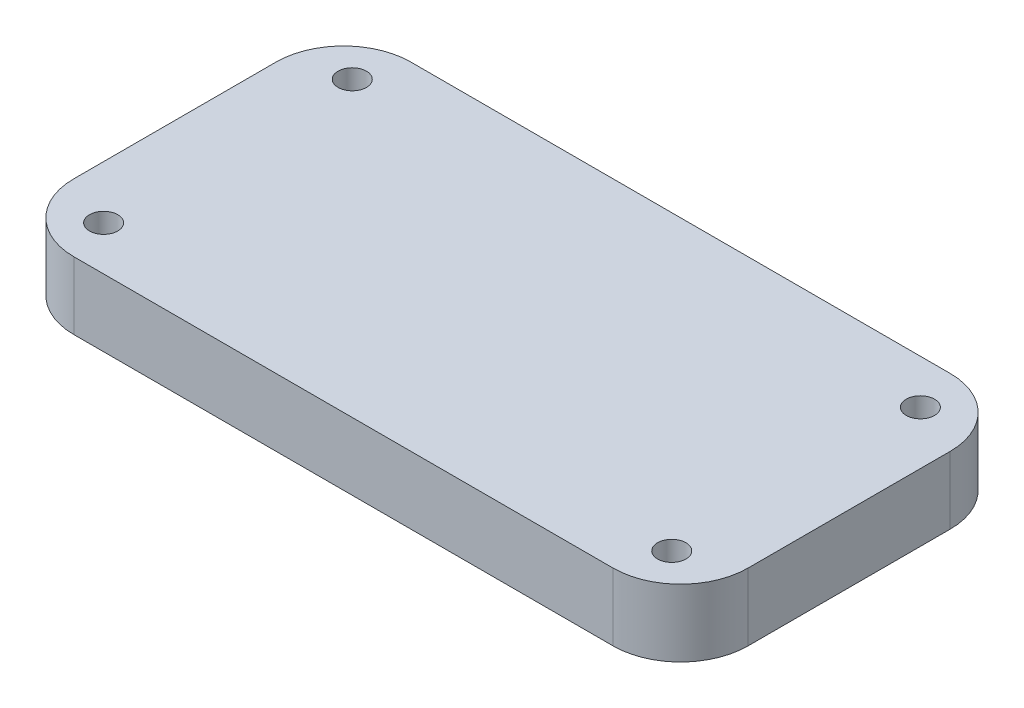
from build123d import *

# Parameters (mm, degrees)
SKETCH1_W           = 100
SKETCH1_H           = 50
BOSS_EXTRUDE1_DEPTH = 10
FILLET1_R           = 10
SKETCH2_R           = 2.1
CUT_EXTRUDE1_DEPTH  = 10


with BuildPart() as part:
    # Sketch1 → Boss-Extrude1 (new body)
    with BuildSketch(Plane(origin=(0, 0, 0), x_dir=(1, 0, 0), z_dir=(0, 1, 0))):
        Rectangle(SKETCH1_W, SKETCH1_H)
    extrude(amount=BOSS_EXTRUDE1_DEPTH)

    # Fillet1
    fillet1_edges = [part.edges().sort_by_distance(p)[0] for p in [
        (-50, 5, -25),
        (50, 5, -25),
        (50, 5, 25),
        (-50, 5, 25),
    ]]
    fillet(fillet1_edges, radius=FILLET1_R)

    # Sketch2 → Cut-Extrude1 (cut)
    with BuildSketch(Plane(origin=(0, 10, 0), x_dir=(1, 0, 0), z_dir=(0, 1, 0))):
        with Locations(Location((-42.132384366, 18.438889303, 0), (0, 0, 270))):
            Circle(SKETCH2_R)
        with Locations(Location((42.132384366, 18.438889303, 0), (0, 0, 270))):
            Circle(SKETCH2_R)
        with Locations(Location((42.132384366, -18.438889303, 0), (0, 0, 270))):
            Circle(SKETCH2_R)
        with Locations(Location((-42.132384366, -18.438889303, 0), (0, 0, 270))):
            Circle(SKETCH2_R)
    extrude(amount=-CUT_EXTRUDE1_DEPTH, mode=Mode.SUBTRACT)


solid = part.part
